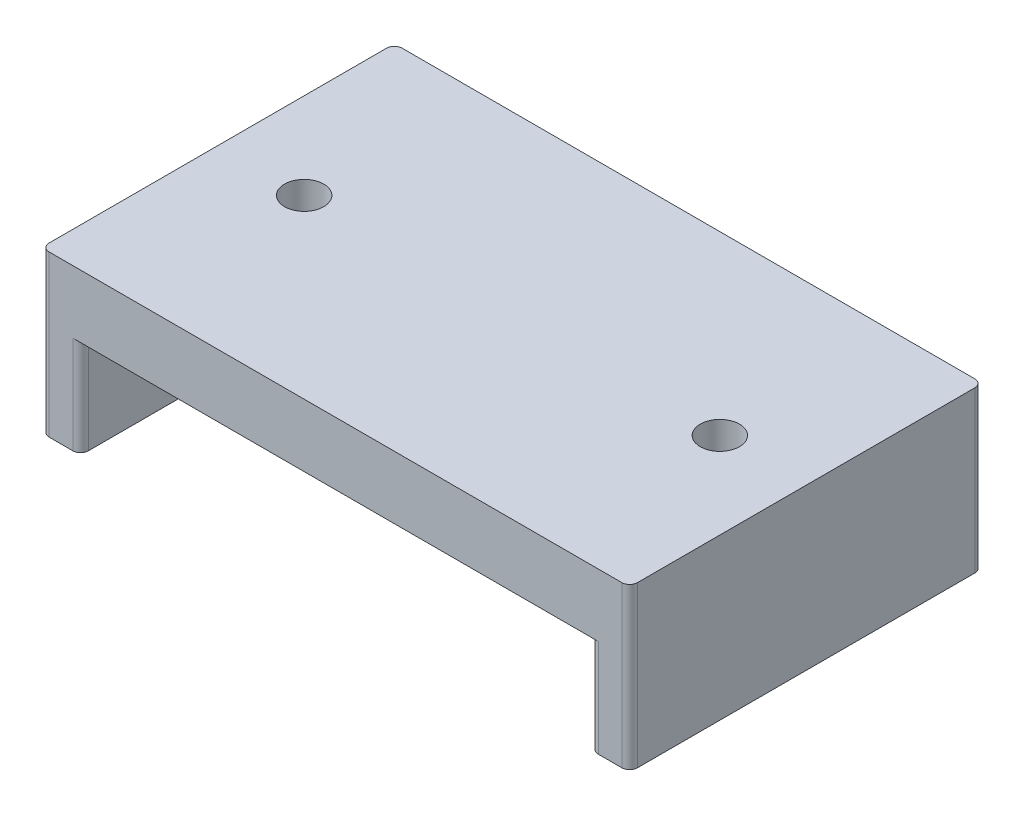
from build123d import *

# Parameters (mm, degrees)
BOSS_EXTRUDE1_DEPTH = 45
SKETCH2_R           = 2.5
CUT_EXTRUDE1_DEPTH  = 89.345925203
FILLET1_R           = 1


with BuildPart() as part:
    # Sketch1 → Boss-Extrude1 (new body)
    with BuildSketch(Plane.XY):
        Polygon((0, 0), (5, 0), (5, 12.45), (70, 12.45), (70, 0), (75, 0), (75, 20.45), (0, 20.45), align=None)
    extrude(amount=BOSS_EXTRUDE1_DEPTH)

    # Sketch2 → Cut-Extrude1 (cut, through all)
    with BuildSketch(Plane.XZ.offset(-12.45)):
        with Locations(Location((11, 22.5, 0), (0, 0, 270))):
            Circle(SKETCH2_R)
        with Locations(Location((64, 22.5, 0), (0, 0, 270))):
            Circle(SKETCH2_R)
    extrude(amount=-CUT_EXTRUDE1_DEPTH, mode=Mode.SUBTRACT)

    # Fillet1
    fillet1_edges = [part.edges().sort_by_distance(p)[0] for p in [
        (5, 6.225, 0),
        (0, 10.225, 0),
        (5, 6.225, 45),
        (70, 6.225, 45),
        (75, 10.225, 45),
        (0, 10.225, 45),
        (75, 10.225, 0),
        (70, 6.225, 0),
    ]]
    fillet(fillet1_edges, radius=FILLET1_R)


solid = part.part
